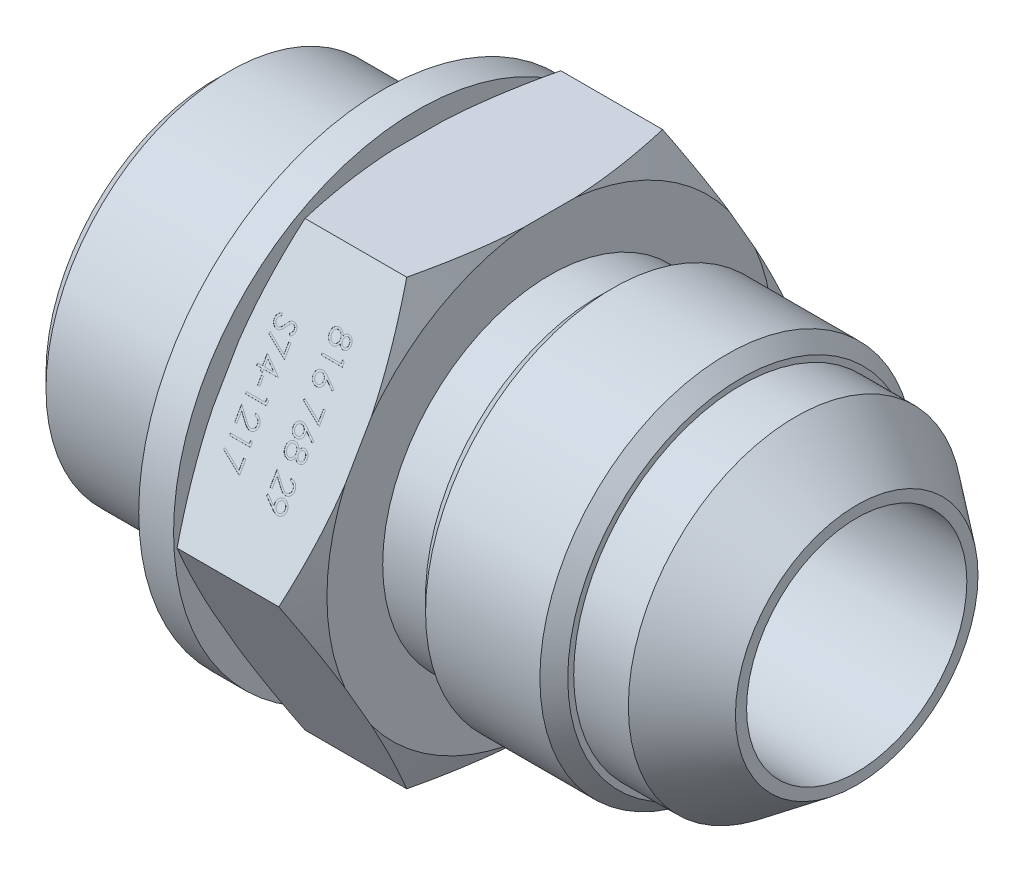
from build123d import *

# Parameters (mm, degrees)
SKETCH2_OUTSIDE_W  = 52.57
SKETCH2_OUTSIDE_H  = 52.57
EXTRUDE1_DEPTH     = 9.5
SKETCH3_R          = 17.5
SKETCH3_R_2        = 14.5
EXTRUDE2_DEPTH     = 2.5
CHAMFER1_SIZE      = 1
CHAMFER2_SIZE      = 1
SKETCH4_W          = 0.153846154
SKETCH4_H          = 0.576923077
CUT_EXTRUDE1_DEPTH = 0.01
SKETCH5_R          = 1.5


with BuildPart() as part:
    # Sketch1 → Revolve1 (revolve)
    with BuildSketch(Plane.XY, mode=Mode.PRIVATE) as revolve1_sk:
        Polygon((0, 10.5), (0, 13.15), (11.4, 13.15), (12.5, 12.05), (14.5, 12.05), (14.5, 16), (15.6, 18.35), (22.9, 18.35), (24, 16), (24, 12), (27.5, 12), (27.5, 13.425), (37.7, 13.425), (37.7, 12), (41.620752089, 12), (46, 8.7), (46, 7.9), (13, 7.9), (4.5033321, 7.9), align=None)
    revolve(revolve1_sk.sketch.rotate(Axis((0, 0, 0), (1, 0, 0)), 90), axis=Axis((0, 0, 0), (1, 0, 0)))

    # Sketch2 outside → Extrude1 (cut)
    with BuildSketch(Plane(origin=(24, 0, 0), x_dir=(0, 0, -1), z_dir=(1, 0, 0))):
        Rectangle(SKETCH2_OUTSIDE_W, SKETCH2_OUTSIDE_H)
        Polygon((9.175, 15.891566159), (-9.175, 15.891566159), (-18.35, 0), (-9.175, -15.891566159), (9.175, -15.891566159), (18.35, 0), align=None, mode=Mode.SUBTRACT)
    extrude(amount=-EXTRUDE1_DEPTH, mode=Mode.SUBTRACT)

    # Sketch3 → Extrude2 (add)
    with BuildSketch(Plane.ZY.offset(-14.5)):
        Circle(SKETCH3_R)
        Circle(SKETCH3_R_2, mode=Mode.SUBTRACT)
    extrude(amount=EXTRUDE2_DEPTH)

    # Chamfer1
    chamfer1_edges = [part.edges().sort_by_distance(p)[0] for p in [
        (0, 0, -13.15),
    ]]
    chamfer(chamfer1_edges, length=CHAMFER1_SIZE)

    # Chamfer2
    chamfer2_edges = [part.edges().sort_by_distance(p)[0] for p in [
        (27.5, 0, -13.425),
        (37.7, 0, -13.425),
    ]]
    chamfer(chamfer2_edges, length=CHAMFER2_SIZE)

    # Sketch4 → Cut-Extrude1 (cut)
    # profile 1 of 16: a face of its own
    with BuildSketch(Plane(origin=(0, 7.94578308, 13.7625), x_dir=(1, 0, 0), z_dir=(0, -0.49999999999999983, -0.8660254037844389))):
        with BuildLine():
            Line((19.631451776, 4.423076923), (19.706271487, 4.315504808))
            Line((19.706271487, 4.315504808), (20.315946968, 4.732572115))
            add(Edge.make_bspline(
                [(20.315946968, 4.732572115), (20.312692798, 4.7059618), (20.306285156, 4.653564606), (20.305108018, 4.600791562), (20.304528699, 4.574819712)],
                knots=[0, 0, 0, 0, 1.015715272, 2, 2, 2, 2], degree=3))
            add(Edge.make_bspline(
                [(20.304528699, 4.574819712), (20.304933213, 4.559073555), (20.30572724, 4.528165227), (20.31198529, 4.482716896), (20.321732934, 4.438981768), (20.335940793, 4.397126432), (20.354098808, 4.357188173), (20.376217641, 4.319027626), (20.402379622, 4.282695319), (20.432303537, 4.248618772), (20.465166767, 4.217628547), (20.499947443, 4.190018427), (20.537051512, 4.167072263), (20.575721584, 4.14801086), (20.616513597, 4.133554954), (20.658963339, 4.123028151), (20.703368329, 4.116547142), (20.733593385, 4.115776101), (20.748939756, 4.115384615)],
                knots=[0, 0, 0, 0, 1.060702494, 2.082066239, 3.085748733, 4.076089625, 5.054723785, 6.037561548, 7.043420247, 8.066922603, 9.088643095, 10.08373341, 11.053858765, 12.022809492, 12.983497605, 13.964038393, 14.966267459, 16, 16, 16, 16], degree=3))
            add(Edge.make_bspline(
                [(20.748939756, 4.115384615), (20.769926322, 4.116127945), (20.811118693, 4.117586949), (20.871304594, 4.129329171), (20.928213112, 4.148640745), (20.981694624, 4.175567192), (21.030979798, 4.209482072), (21.075383487, 4.250242897), (21.114274139, 4.297601739), (21.147704458, 4.350479747), (21.174590885, 4.407631041), (21.194407729, 4.467489038), (21.206064335, 4.529595089), (21.207601132, 4.571666948), (21.208374853, 4.592848558)],
                knots=[0, 0, 0, 0, 1.022988612, 2.007919123, 2.978103895, 3.94594894, 4.918897164, 5.887013414, 6.875921846, 7.89917871, 8.930658928, 9.948724884, 10.967259574, 12, 12, 12, 12], degree=3))
            add(Edge.make_bspline(
                [(21.208374853, 4.592848558), (21.207593316, 4.613630119), (21.206049072, 4.654692525), (21.194640177, 4.715155637), (21.175616596, 4.773117579), (21.149206428, 4.828122315), (21.115887338, 4.878787502), (21.076512293, 4.924522424), (21.030637625, 4.964101834), (20.979518143, 4.997457697), (20.924588323, 5.024229829), (20.867252649, 5.043546717), (20.807921692, 5.055437654), (20.76772407, 5.056936087), (20.747437353, 5.057692308)],
                knots=[0, 0, 0, 0, 1.026337322, 2.02794581, 3.027878252, 4.032696425, 5.033228651, 6.015458494, 7.004668777, 8.016190509, 9.023163053, 10.0152653, 10.998354841, 12, 12, 12, 12], degree=3))
            add(Edge.make_bspline(
                [(20.747437353, 5.057692308), (20.731688763, 5.057193513), (20.699746689, 5.056181834), (20.651262436, 5.048914006), (20.601724451, 5.037142911), (20.559740106, 5.023488944), (20.525416347, 5.009507243), (20.497870663, 4.997477825), (20.469124585, 4.983476503), (20.439389387, 4.966844984), (20.407882738, 4.949457333), (20.375292705, 4.929687253), (20.341437174, 4.908136418), (20.318617674, 4.892779597), (20.306932545, 4.884915865)],
                knots=[0, 0, 0, 0, 1.179688711, 2.392703466, 3.66501481, 4.991562144, 5.695278944, 6.441221078, 7.243328977, 8.089575748, 8.993388627, 9.939305498, 10.944784961, 12, 12, 12, 12], degree=3))
            Line((20.306932545, 4.884915865), (19.631451776, 4.423076923))
        make_face()
        with BuildLine():
            add(Edge.make_bspline(
                [(20.458374853, 4.599759615), (20.458700731, 4.611688479), (20.459335106, 4.63490992), (20.46319621, 4.668928762), (20.470042204, 4.701039135), (20.479864938, 4.731326813), (20.491717796, 4.760095486), (20.506808647, 4.786888198), (20.524815776, 4.811727373), (20.54504864, 4.834779342), (20.567527462, 4.855249627), (20.591054793, 4.873482355), (20.615733912, 4.888979741), (20.641873881, 4.901221145), (20.668838399, 4.911285963), (20.697061694, 4.91823654), (20.726396723, 4.922086968), (20.74632472, 4.922743358), (20.756451776, 4.923076923)],
                knots=[0, 0, 0, 0, 1.163407946, 2.26475976, 3.333800367, 4.359385343, 5.366239384, 6.363380779, 7.350133999, 8.353570782, 9.349036268, 10.310270964, 11.253520213, 12.184142, 13.120487599, 14.056272588, 15.012232024, 16, 16, 16, 16], degree=3))
            add(Edge.make_bspline(
                [(20.756451776, 4.923076923), (20.766583083, 4.922789948), (20.786548067, 4.922224429), (20.815926208, 4.91768664), (20.844081647, 4.909705795), (20.871161409, 4.898990381), (20.89696962, 4.88490128), (20.921674621, 4.867931751), (20.945581776, 4.848166493), (20.967459834, 4.824970618), (20.987887608, 4.800014066), (21.005596319, 4.773180214), (21.020712657, 4.745134674), (21.033079848, 4.715855099), (21.042749787, 4.685280542), (21.049698739, 4.65340935), (21.053544144, 4.620085854), (21.054196334, 4.597465268), (21.054528699, 4.5859375)],
                knots=[0, 0, 0, 0, 0.972051712, 1.915547132, 2.843788449, 3.775556853, 4.704594175, 5.659091977, 6.648619647, 7.675179132, 8.714041218, 9.74046568, 10.755438548, 11.767722258, 12.786148662, 13.828784001, 14.893517844, 16, 16, 16, 16], degree=3))
            add(Edge.make_bspline(
                [(21.054528699, 4.5859375), (21.054195857, 4.574509959), (21.053542825, 4.552089219), (21.049705367, 4.519062378), (21.042705528, 4.48740518), (21.033075178, 4.45692475), (21.020779926, 4.42770689), (21.005596434, 4.399884438), (20.987793018, 4.373330204), (20.967485846, 4.348380769), (20.945476743, 4.32523463), (20.921779081, 4.305121284), (20.896956541, 4.288191077), (20.871164885, 4.27408244), (20.844080719, 4.263372222), (20.81592646, 4.255389987), (20.786548001, 4.250852572), (20.766583061, 4.250287001), (20.756451776, 4.25)],
                knots=[0, 0, 0, 0, 1.099545523, 2.15729926, 3.193054709, 4.213957097, 5.228701859, 6.237665598, 7.258567987, 8.299955741, 9.329010984, 10.327149711, 11.283968076, 12.215264062, 13.149297769, 14.079795814, 15.025585048, 16, 16, 16, 16], degree=3))
            add(Edge.make_bspline(
                [(20.756451776, 4.25), (20.746316833, 4.250259683), (20.726328872, 4.250771824), (20.696960418, 4.255712306), (20.668808335, 4.263974426), (20.641598889, 4.275039879), (20.615596664, 4.289611989), (20.590924938, 4.307493638), (20.56730403, 4.328453158), (20.54510094, 4.352210367), (20.524721436, 4.378211007), (20.506922701, 4.405981041), (20.491891653, 4.4350424), (20.47983106, 4.465497384), (20.470140347, 4.497120299), (20.463208828, 4.530195355), (20.459372142, 4.564613171), (20.458710472, 4.587931735), (20.458374853, 4.599759615)],
                knots=[0, 0, 0, 0, 0.952633368, 1.87876736, 2.791047057, 3.707742249, 4.635551637, 5.587206343, 6.568248508, 7.601284464, 8.641511608, 9.671105535, 10.699146789, 11.713763218, 12.747829548, 13.806491675, 14.887386225, 16, 16, 16, 16], degree=3))
        make_face(mode=Mode.SUBTRACT)
    # profile 2 of 16: a face of its own
    with BuildSketch(Plane(origin=(0, 7.94578308, 13.7625), x_dir=(1, 0, 0), z_dir=(0, -0.49999999999999983, -0.8660254037844389))):
        with BuildLine():
            Line((20.708374853, 3.134615385), (20.708374853, 3))
            add(Edge.make_bspline(
                [(20.708374853, 3), (20.726233893, 3.000877202), (20.761308572, 3.002600003), (20.812446143, 3.010671383), (20.861331279, 3.022209826), (20.907544881, 3.03856249), (20.951639007, 3.058756602), (20.993028139, 3.083480039), (21.03212306, 3.112205738), (21.068183572, 3.144880999), (21.101147389, 3.180336669), (21.129914566, 3.218360313), (21.153941931, 3.258561121), (21.174137486, 3.300590406), (21.189278295, 3.344934251), (21.200517462, 3.391168778), (21.207278392, 3.439502962), (21.208005207, 3.472434362), (21.208374853, 3.489182692)],
                knots=[0, 0, 0, 0, 1.100776268, 2.161895295, 3.184016182, 4.190939212, 5.176500551, 6.166955529, 7.155448256, 8.160289653, 9.16017456, 10.133824356, 11.091467644, 12.04088621, 13.000931625, 13.972173743, 14.968683325, 16, 16, 16, 16], degree=3))
            add(Edge.make_bspline(
                [(21.208374853, 3.489182692), (21.2079898, 3.505630438), (21.207233185, 3.537949672), (21.200735601, 3.585119107), (21.190558919, 3.630023661), (21.176280883, 3.672575561), (21.157087557, 3.712435303), (21.134031469, 3.749902322), (21.107365827, 3.78542267), (21.075971336, 3.817397006), (21.042456028, 3.846757611), (21.006675498, 3.872087149), (20.96972009, 3.893778505), (20.931308003, 3.911858939), (20.891077563, 3.925168713), (20.849614476, 3.935273659), (20.806489557, 3.940985408), (20.777301033, 3.941862018), (20.762461391, 3.942307692)],
                knots=[0, 0, 0, 0, 1.111607364, 2.184268762, 3.212621178, 4.221274766, 5.211760367, 6.196651075, 7.1921475, 8.207485113, 9.220403448, 10.201281604, 11.166441695, 12.114753415, 13.065576456, 14.026450734, 14.996634279, 16, 16, 16, 16], degree=3))
            add(Edge.make_bspline(
                [(20.762461391, 3.942307692), (20.741569462, 3.941582008), (20.700152228, 3.940143375), (20.639288715, 3.927837213), (20.580320107, 3.90861728), (20.532861263, 3.885475556), (20.494618337, 3.862130223), (20.463131749, 3.841092719), (20.429229406, 3.816464943), (20.393024832, 3.787888444), (20.354234445, 3.755954356), (20.312881675, 3.720373429), (20.269393774, 3.680891937), (20.239691373, 3.65318115), (20.224300333, 3.638822115)],
                knots=[0, 0, 0, 0, 1.184426356, 2.348067706, 3.509069118, 4.696110526, 5.333549288, 6.050745305, 6.844228056, 7.710549037, 8.667450064, 9.695053472, 10.805634456, 12, 12, 12, 12], degree=3))
            Line((20.224300333, 3.638822115), (19.823759468, 3.263521635))
            Line((19.823759468, 3.263521635), (19.823759468, 3.961538462))
            Line((19.823759468, 3.961538462), (19.669913314, 3.961538462))
            Line((19.669913314, 3.961538462), (19.669913314, 2.942307692))
            Line((19.669913314, 2.942307692), (20.290706583, 3.524038462))
            add(Edge.make_bspline(
                [(20.290706583, 3.524038462), (20.305490765, 3.538202844), (20.333888154, 3.565409725), (20.375360032, 3.603874779), (20.41378889, 3.638478155), (20.449345016, 3.669242805), (20.481826839, 3.696194044), (20.511488913, 3.719245639), (20.538076685, 3.738499474), (20.569310888, 3.758904528), (20.607491258, 3.7783621), (20.65391497, 3.795463315), (20.701810224, 3.805816157), (20.734166617, 3.807064421), (20.75044216, 3.807692308)],
                knots=[0, 0, 0, 0, 1.329530082, 2.553755191, 3.672934919, 4.687409497, 5.60679272, 6.413407421, 7.126401618, 7.737995624, 8.834647426, 9.90044882, 10.943907757, 12, 12, 12, 12], degree=3))
            add(Edge.make_bspline(
                [(20.75044216, 3.807692308), (20.760678176, 3.807422645), (20.780851398, 3.806891193), (20.810409067, 3.802112023), (20.839031437, 3.795090474), (20.866364614, 3.784268099), (20.892946188, 3.771265412), (20.917967996, 3.754653522), (20.942282971, 3.735670494), (20.965057374, 3.713651112), (20.985922264, 3.689477922), (21.004403619, 3.6639367), (21.019849055, 3.636915443), (21.032510527, 3.608526762), (21.04244284, 3.578850148), (21.049325087, 3.54782811), (21.053646152, 3.51554639), (21.054230797, 3.493503463), (21.054528699, 3.482271635)],
                knots=[0, 0, 0, 0, 0.991504627, 1.954065223, 2.895985987, 3.842598665, 4.797835564, 5.759220273, 6.74786863, 7.784730864, 8.824135544, 9.839918996, 10.835834653, 11.835434876, 12.84861661, 13.863796685, 14.911511676, 16, 16, 16, 16], degree=3))
            add(Edge.make_bspline(
                [(21.054528699, 3.482271635), (21.054222349, 3.470541226), (21.053620729, 3.447504639), (21.049409701, 3.413682935), (21.042151984, 3.381414913), (21.032201807, 3.350635254), (21.019674457, 3.321314301), (21.003770042, 3.293717175), (20.985109529, 3.267591922), (20.963837564, 3.242986526), (20.94004235, 3.220378028), (20.91384345, 3.200096368), (20.885070443, 3.182798256), (20.854373225, 3.167464258), (20.820935595, 3.15573148), (20.785567825, 3.145702415), (20.747767421, 3.13841704), (20.721723799, 3.13590365), (20.708374853, 3.134615385)],
                knots=[0, 0, 0, 0, 1.031212865, 2.025131798, 2.990757446, 3.934781266, 4.865570067, 5.788494791, 6.729227313, 7.684356718, 8.643577152, 9.610526866, 10.590658432, 11.59095419, 12.621640561, 13.700587263, 14.82141059, 16, 16, 16, 16], degree=3))
        make_face()
    # profile 3 of 16: a face of its own
    with BuildSketch(Plane(origin=(0, 7.94578308, 13.7625), x_dir=(1, 0, 0), z_dir=(0, -0.49999999999999983, -0.8660254037844389))):
        with BuildLine():
            add(Edge.make_bspline(
                [(20.505550333, 1.940805288), (20.499140526, 1.952979437), (20.486600156, 1.976797364), (20.466472927, 2.010876299), (20.445447398, 2.042252205), (20.424183578, 2.07137223), (20.401840971, 2.097642424), (20.378674603, 2.121236616), (20.355305028, 2.142895019), (20.330817833, 2.161478971), (20.305718072, 2.177866595), (20.279789988, 2.192010047), (20.253115364, 2.204104356), (20.225396433, 2.213688148), (20.197042114, 2.22158329), (20.167685815, 2.227015668), (20.137521103, 2.229937211), (20.117134687, 2.230489558), (20.106812353, 2.230769231)],
                knots=[0, 0, 0, 0, 1.264385854, 2.473688339, 3.635349404, 4.734491366, 5.785876313, 6.801388178, 7.772322209, 8.711311751, 9.622826105, 10.524996139, 11.423212571, 12.31118177, 13.217849097, 14.126010572, 15.051135535, 16, 16, 16, 16], degree=3))
            add(Edge.make_bspline(
                [(20.106812353, 2.230769231), (20.092369475, 2.230441563), (20.063781603, 2.229792985), (20.02160483, 2.224050235), (19.980545133, 2.215668812), (19.940999468, 2.202617123), (19.90247228, 2.187027694), (19.865668008, 2.166972806), (19.829557512, 2.144466852), (19.807351454, 2.126353046), (19.796115237, 2.1171875)],
                knots=[0, 0, 0, 0, 1.02534174, 2.029536028, 3.018826961, 3.997522084, 4.983122576, 5.966563916, 6.971085759, 8, 8, 8, 8], degree=3))
            add(Edge.make_bspline(
                [(19.796115237, 2.1171875), (19.78300362, 2.105257582), (19.756942409, 2.081545169), (19.723106347, 2.040923914), (19.694670893, 1.996343107), (19.671497223, 1.94797525), (19.653460427, 1.895949635), (19.640499348, 1.840277347), (19.633075449, 1.780849853), (19.632002311, 1.740004651), (19.631451776, 1.719050481)],
                knots=[0, 0, 0, 0, 0.954267603, 1.896743057, 2.838368354, 3.796610408, 4.779680527, 5.799409237, 6.871065594, 8, 8, 8, 8], degree=3))
            add(Edge.make_bspline(
                [(19.631451776, 1.719050481), (19.63194702, 1.69890235), (19.632910716, 1.659696133), (19.639404367, 1.602622083), (19.65090061, 1.549355512), (19.666310204, 1.499643883), (19.686859247, 1.453967846), (19.712046435, 1.412244519), (19.741302857, 1.373861767), (19.775333601, 1.340025927), (19.811787991, 1.309988454), (19.849395565, 1.283602035), (19.888161355, 1.261670316), (19.927506924, 1.243101553), (19.967983852, 1.228886688), (20.009383856, 1.219041455), (20.051634632, 1.212788892), (20.080148198, 1.211956977), (20.094492641, 1.211538462)],
                knots=[0, 0, 0, 0, 1.256882982, 2.445766618, 3.576898315, 4.651879663, 5.686612882, 6.692806257, 7.686348993, 8.689277895, 9.678883454, 10.630458183, 11.551151498, 12.454054546, 13.341321255, 14.221808008, 15.105437234, 16, 16, 16, 16], degree=3))
            add(Edge.make_bspline(
                [(20.094492641, 1.211538462), (20.105018017, 1.211786113), (20.125819875, 1.212275559), (20.156552329, 1.215663524), (20.186465385, 1.221109368), (20.215666982, 1.228508645), (20.243953954, 1.238524595), (20.271425142, 1.250661149), (20.298291614, 1.26467552), (20.324091506, 1.281473278), (20.349684642, 1.299966792), (20.373820948, 1.321904303), (20.397845011, 1.34596461), (20.420717311, 1.373130066), (20.443537181, 1.402569204), (20.464852401, 1.435174301), (20.486222542, 1.470029304), (20.498997195, 1.494803407), (20.505550333, 1.507512019)],
                knots=[0, 0, 0, 0, 0.941717298, 1.86116577, 2.762973304, 3.660719123, 4.553575492, 5.444450535, 6.34648071, 7.261375261, 8.197060099, 9.168336537, 10.175980388, 11.237504102, 12.343496232, 13.506792996, 14.721035322, 16, 16, 16, 16], degree=3))
            add(Edge.make_bspline(
                [(20.505550333, 1.507512019), (20.515035185, 1.490113914), (20.533400512, 1.456426312), (20.567169162, 1.411849532), (20.603608913, 1.373498458), (20.643924111, 1.342859358), (20.686339125, 1.31854698), (20.730718033, 1.301378419), (20.776529442, 1.290167136), (20.807769519, 1.289031753), (20.823458987, 1.288461538)],
                knots=[0, 0, 0, 0, 1.16709546, 2.25982348, 3.287408737, 4.277418348, 5.234967981, 6.16072867, 7.076276605, 8, 8, 8, 8], degree=3))
            add(Edge.make_bspline(
                [(20.823458987, 1.288461538), (20.839443638, 1.289162448), (20.871575574, 1.290571399), (20.919407031, 1.301964041), (20.966384512, 1.320530623), (21.012286819, 1.34577916), (21.055535207, 1.377243628), (21.094455036, 1.414984942), (21.128252942, 1.458357326), (21.156806521, 1.5065907), (21.180161584, 1.558395752), (21.196104656, 1.613149053), (21.206590709, 1.669872144), (21.207774585, 1.70848619), (21.208374853, 1.728064904)],
                knots=[0, 0, 0, 0, 0.888753872, 1.786550278, 2.720173491, 3.693036334, 4.694165094, 5.687489879, 6.699912706, 7.744713188, 8.800178723, 9.852977058, 10.911381959, 12, 12, 12, 12], degree=3))
            add(Edge.make_bspline(
                [(21.208374853, 1.728064904), (21.207757646, 1.747138655), (21.206540586, 1.78474992), (21.196290435, 1.840117596), (21.179361122, 1.893137777), (21.156309762, 1.943521145), (21.127564023, 1.99016684), (21.093425156, 2.031814225), (21.054642081, 2.068346746), (21.011510821, 2.098699756), (20.965609627, 2.123194901), (20.917871543, 2.140639186), (20.868936271, 2.151735174), (20.835836161, 2.153141535), (20.819252256, 2.153846154)],
                knots=[0, 0, 0, 0, 1.072712831, 2.115267497, 3.156282165, 4.197922255, 5.225560591, 6.230883479, 7.219814004, 8.214446311, 9.19021444, 10.138875805, 11.067534608, 12, 12, 12, 12], degree=3))
            add(Edge.make_bspline(
                [(20.819252256, 2.153846154), (20.802976447, 2.153231431), (20.771011682, 2.152024149), (20.724415978, 2.141865772), (20.680772825, 2.124764768), (20.639618187, 2.101392292), (20.601521463, 2.070977302), (20.566609315, 2.033571901), (20.533493901, 1.990336935), (20.515073065, 1.9576849), (20.505550333, 1.940805288)],
                knots=[0, 0, 0, 0, 0.975287281, 1.915408787, 2.843441052, 3.776938647, 4.743139116, 5.754296123, 6.83907365, 8, 8, 8, 8], degree=3))
        make_face()
        with BuildLine():
            add(Edge.make_bspline(
                [(21.054528699, 1.720552885), (21.05424951, 1.710031111), (21.053703295, 1.68944592), (21.050849593, 1.659262204), (21.045298214, 1.630559761), (21.037910195, 1.603038703), (21.027929629, 1.577076355), (21.016188911, 1.552320118), (21.001914882, 1.529191322), (20.98590294, 1.507410764), (20.968291695, 1.487803289), (20.949942958, 1.470401338), (20.930496362, 1.455946432), (20.910435636, 1.443671671), (20.889165389, 1.434765306), (20.867337742, 1.42809489), (20.844676863, 1.423585722), (20.829189787, 1.423247841), (20.821355622, 1.423076923)],
                knots=[0, 0, 0, 0, 1.203892937, 2.355340988, 3.463153438, 4.544400666, 5.610487187, 6.640501085, 7.674077295, 8.714426146, 9.728707835, 10.68524104, 11.601827946, 12.495867327, 13.368432065, 14.231010473, 15.105153427, 16, 16, 16, 16], degree=3))
            add(Edge.make_bspline(
                [(20.821355622, 1.423076923), (20.813524648, 1.423381682), (20.798049517, 1.42398393), (20.775105477, 1.428343019), (20.752851969, 1.435631452), (20.73108125, 1.445625461), (20.709849201, 1.458450901), (20.689074464, 1.474017155), (20.669306408, 1.492999639), (20.649984177, 1.51396203), (20.63218232, 1.536859732), (20.616280726, 1.560921052), (20.603604116, 1.58632159), (20.592489319, 1.61230066), (20.584151933, 1.639407658), (20.578145337, 1.667455678), (20.574429883, 1.696414759), (20.573984708, 1.716034675), (20.573759468, 1.725961538)],
                knots=[0, 0, 0, 0, 0.873213166, 1.72559466, 2.594724523, 3.479581045, 4.391597569, 5.35687048, 6.368548091, 7.443976143, 8.534559525, 9.600545123, 10.654815915, 11.696401765, 12.749428718, 13.812189468, 14.893058657, 16, 16, 16, 16], degree=3))
            add(Edge.make_bspline(
                [(20.573759468, 1.725961538), (20.574133554, 1.738711583), (20.574878031, 1.764085741), (20.581799963, 1.801491168), (20.592688213, 1.837860873), (20.607585341, 1.872806118), (20.626282996, 1.905422369), (20.648668575, 1.934496684), (20.674225188, 1.959781066), (20.702554975, 1.981012756), (20.732705655, 1.997474119), (20.762962924, 2.01028918), (20.793649594, 2.017772558), (20.814206864, 2.018748658), (20.82436043, 2.019230769)],
                knots=[0, 0, 0, 0, 1.076279235, 2.141928126, 3.20205304, 4.278698113, 5.344010996, 6.36967002, 7.368914609, 8.37248503, 9.349703398, 10.264243087, 11.142681841, 12, 12, 12, 12], degree=3))
            add(Edge.make_bspline(
                [(20.82436043, 2.019230769), (20.831487074, 2.019003402), (20.845632443, 2.018552112), (20.866515259, 2.01481485), (20.886947298, 2.008686977), (20.906933511, 2.0002347), (20.926754942, 1.989763831), (20.945574798, 1.976237396), (20.96444045, 1.960882608), (20.982515833, 1.943045409), (20.999536006, 1.922936909), (21.014177731, 1.900239652), (21.026893832, 1.875530987), (21.037111395, 1.848609332), (21.044806816, 1.819579736), (21.050563566, 1.788553081), (21.053809667, 1.755277215), (21.054283823, 1.732378704), (21.054528699, 1.720552885)],
                knots=[0, 0, 0, 0, 0.814272661, 1.61621452, 2.416847352, 3.248328223, 4.093649164, 4.973549185, 5.892801723, 6.872536627, 7.872406081, 8.898230315, 9.953166191, 11.044090313, 12.18293744, 13.382234284, 14.648068262, 16, 16, 16, 16], degree=3))
        make_face(mode=Mode.SUBTRACT)
        with BuildLine():
            add(Edge.make_bspline(
                [(20.419913314, 1.729266827), (20.419676129, 1.715927157), (20.419210828, 1.689757979), (20.414028349, 1.651419971), (20.406820356, 1.614623298), (20.395861909, 1.579506512), (20.381730618, 1.546112665), (20.364441346, 1.514366534), (20.344309674, 1.484223197), (20.321225613, 1.456176554), (20.29622499, 1.43062314), (20.270096629, 1.407810358), (20.242652861, 1.388821282), (20.214138492, 1.373304736), (20.184589044, 1.361285138), (20.154010452, 1.352410001), (20.12231132, 1.347258114), (20.100820805, 1.346523988), (20.08998543, 1.346153846)],
                knots=[0, 0, 0, 0, 1.140506561, 2.237395584, 3.304560074, 4.345354409, 5.3782877, 6.402081073, 7.433555996, 8.474808822, 9.504965884, 10.489266388, 11.437701257, 12.354123303, 13.261162422, 14.161620169, 15.073101032, 16, 16, 16, 16], degree=3))
            add(Edge.make_bspline(
                [(20.08998543, 1.346153846), (20.076514179, 1.346736488), (20.049787533, 1.347892436), (20.01030187, 1.35711206), (19.971968047, 1.371793734), (19.935460556, 1.39277605), (19.901234177, 1.418213911), (19.871057645, 1.44928958), (19.8448234, 1.484788356), (19.823312685, 1.525064348), (19.806057758, 1.56899861), (19.794317155, 1.61670501), (19.786486197, 1.667510016), (19.785700261, 1.702593295), (19.78529793, 1.720552885)],
                knots=[0, 0, 0, 0, 0.898956152, 1.783507998, 2.694187257, 3.631865312, 4.587204618, 5.533364321, 6.51415483, 7.525942309, 8.574485006, 9.65837228, 10.801290154, 12, 12, 12, 12], degree=3))
            add(Edge.make_bspline(
                [(19.78529793, 1.720552885), (19.785567114, 1.734588877), (19.78609157, 1.761935493), (19.790730495, 1.801827796), (19.798065282, 1.839481422), (19.808835481, 1.874877894), (19.821738831, 1.908441391), (19.838613682, 1.939421371), (19.857697743, 1.96864299), (19.88034887, 1.994734493), (19.904572984, 2.01846274), (19.930085367, 2.039245639), (19.956626194, 2.056834656), (19.984181031, 2.071013021), (20.012648335, 2.082272015), (20.042145038, 2.090388464), (20.072786981, 2.095390861), (20.093572143, 2.095897191), (20.104108026, 2.096153846)],
                knots=[0, 0, 0, 0, 1.22469164, 2.386092043, 3.500511288, 4.568136916, 5.611981868, 6.63276519, 7.641422348, 8.65223666, 9.641383647, 10.598487484, 11.519869765, 12.415254456, 13.298392158, 14.187051141, 15.081026348, 16, 16, 16, 16], degree=3))
            add(Edge.make_bspline(
                [(20.104108026, 2.096153846), (20.114342319, 2.095768169), (20.134522558, 2.095007682), (20.164405857, 2.090112203), (20.193393949, 2.081706614), (20.221362092, 2.06945592), (20.248612566, 2.054389171), (20.27494403, 2.035907792), (20.300147667, 2.013795284), (20.324249763, 1.988749278), (20.346543976, 1.96147018), (20.366263988, 1.932469104), (20.38287216, 1.901974564), (20.396379197, 1.870049698), (20.407002407, 1.836765762), (20.414423545, 1.802147138), (20.419094804, 1.766153322), (20.419637395, 1.741701234), (20.419913314, 1.729266827)],
                knots=[0, 0, 0, 0, 0.917481483, 1.809113215, 2.707052678, 3.61610275, 4.54058801, 5.494688304, 6.493986409, 7.541809048, 8.607637092, 9.648666143, 10.681335566, 11.715370464, 12.751897579, 13.808646822, 14.885650252, 16, 16, 16, 16], degree=3))
        make_face(mode=Mode.SUBTRACT)
    # profile 4 of 16: a face of its own
    with BuildSketch(Plane(origin=(0, 7.94578308, 13.7625), x_dir=(1, 0, 0), z_dir=(0, -0.49999999999999983, -0.8660254037844389))):
        with BuildLine():
            Line((21.208374853, 0.75), (21.126944564, 0.853665865))
            Line((21.126944564, 0.853665865), (20.520874853, 0.457331731))
            add(Edge.make_bspline(
                [(20.520874853, 0.457331731), (20.525080793, 0.483718992), (20.533284955, 0.53519033), (20.53463836, 0.58729), (20.53529793, 0.612680288)],
                knots=[0, 0, 0, 0, 1.025318673, 2, 2, 2, 2], degree=3))
            add(Edge.make_bspline(
                [(20.53529793, 0.612680288), (20.534888167, 0.627925644), (20.534081563, 0.657935673), (20.527874198, 0.701995731), (20.518092007, 0.744333846), (20.503832469, 0.784774537), (20.485617174, 0.823462958), (20.46378623, 0.860621128), (20.437212367, 0.895550561), (20.407527386, 0.928701066), (20.374648678, 0.958798394), (20.339762391, 0.985445275), (20.302904871, 1.007828185), (20.264094785, 1.025988437), (20.22339196, 1.040090528), (20.180848471, 1.050370947), (20.136434984, 1.056447916), (20.106230051, 1.057273126), (20.090886872, 1.057692308)],
                knots=[0, 0, 0, 0, 1.04369286, 2.054478336, 3.041073146, 4.015093852, 4.984733326, 5.965804835, 6.960378782, 7.985147595, 9.009457201, 10.008161701, 10.986880575, 11.956520048, 12.937015923, 13.931873656, 14.949455224, 16, 16, 16, 16], degree=3))
            add(Edge.make_bspline(
                [(20.090886872, 1.057692308), (20.069908049, 1.05690951), (20.02865103, 1.055370057), (19.96830928, 1.044163493), (19.911284385, 1.024823468), (19.857352246, 0.998948833), (19.80808202, 0.965378529), (19.763554948, 0.925595873), (19.724743064, 0.879224808), (19.691447965, 0.827363411), (19.664995051, 0.771233273), (19.645437871, 0.712378987), (19.63375196, 0.651303609), (19.63222203, 0.609825023), (19.631451776, 0.588942308)],
                knots=[0, 0, 0, 0, 1.031881447, 2.029301251, 3.006342947, 3.987068354, 4.962916383, 5.929513747, 6.915671209, 7.928552063, 8.953527267, 9.960179832, 10.973036711, 12, 12, 12, 12], degree=3))
            add(Edge.make_bspline(
                [(19.631451776, 0.588942308), (19.632106719, 0.568758004), (19.633404048, 0.528776431), (19.644960903, 0.469962433), (19.663692427, 0.413449496), (19.689498891, 0.359634858), (19.722093844, 0.309780149), (19.761339548, 0.265191716), (19.806368626, 0.226024691), (19.857319212, 0.193601323), (19.911716353, 0.167176191), (19.968953962, 0.148538163), (20.027880108, 0.136484901), (20.067991827, 0.135241344), (20.088182545, 0.134615385)],
                knots=[0, 0, 0, 0, 1.011913813, 2.004424092, 2.994488568, 3.992479987, 4.990471406, 5.973328987, 6.963763268, 7.974390938, 8.994854117, 9.989689954, 10.988086187, 12, 12, 12, 12], degree=3))
            add(Edge.make_bspline(
                [(20.088182545, 0.134615385), (20.103624599, 0.135159005), (20.135140292, 0.136268481), (20.183009766, 0.142889704), (20.231798579, 0.155033836), (20.273158145, 0.168176441), (20.307411359, 0.181217872), (20.334460217, 0.193310188), (20.363024679, 0.20683087), (20.392564279, 0.222678992), (20.423923026, 0.23947928), (20.455939609, 0.259103923), (20.489783375, 0.27958254), (20.512316028, 0.294584653), (20.52387966, 0.302283654)],
                knots=[0, 0, 0, 0, 1.17367173, 2.395347028, 3.66355231, 4.98980831, 5.690886799, 6.447442954, 7.240630024, 8.091733897, 8.994365608, 9.943299771, 10.944512865, 12, 12, 12, 12], degree=3))
            Line((20.52387966, 0.302283654), (21.208374853, 0.75))
        make_face()
        with BuildLine():
            add(Edge.make_bspline(
                [(20.381451776, 0.584435096), (20.381113911, 0.573008778), (20.380451024, 0.550590437), (20.376707032, 0.517740981), (20.369613193, 0.486735047), (20.36043715, 0.457218497), (20.347943324, 0.429498972), (20.332947192, 0.403260273), (20.31511777, 0.378762766), (20.294653854, 0.356436667), (20.2725761, 0.335935795), (20.248787176, 0.318301696), (20.224013876, 0.303073935), (20.198023361, 0.290697035), (20.170832302, 0.281058156), (20.142563972, 0.274086123), (20.113029291, 0.270205924), (20.093001072, 0.269560399), (20.082773891, 0.269230769)],
                knots=[0, 0, 0, 0, 1.129474985, 2.216020618, 3.260639938, 4.268601163, 5.26556745, 6.258792394, 7.250684778, 8.252748164, 9.247500881, 10.223461414, 11.174097059, 12.117127289, 13.062595836, 14.020469732, 14.98917545, 16, 16, 16, 16], degree=3))
            add(Edge.make_bspline(
                [(20.082773891, 0.269230769), (20.072638571, 0.269499902), (20.052764718, 0.27002763), (20.023470992, 0.274797325), (19.995306682, 0.282135097), (19.968251187, 0.29287565), (19.942452092, 0.306347445), (19.917726137, 0.322925973), (19.894056256, 0.342330521), (19.872039319, 0.364887923), (19.85184485, 0.389213895), (19.833863656, 0.414940221), (19.818764262, 0.441985101), (19.806827001, 0.470502857), (19.7970501, 0.500094218), (19.79016525, 0.530984926), (19.786273964, 0.563202123), (19.785627544, 0.585025775), (19.78529793, 0.596153846)],
                knots=[0, 0, 0, 0, 0.989642335, 1.94054129, 2.892446913, 3.828371744, 4.778262963, 5.730973156, 6.732161388, 7.763274768, 8.805796303, 9.818398792, 10.825975928, 11.825728216, 12.834635236, 13.867465554, 14.912602056, 16, 16, 16, 16], degree=3))
            add(Edge.make_bspline(
                [(19.78529793, 0.596153846), (19.785627519, 0.607281935), (19.786273887, 0.629105623), (19.790165541, 0.661322561), (19.797049032, 0.692214227), (19.80683087, 0.721802106), (19.818749911, 0.750332715), (19.833958271, 0.77740127), (19.851735523, 0.803373213), (19.872074076, 0.827683226), (19.89393185, 0.850334912), (19.917940451, 0.869284963), (19.942255573, 0.886387245), (19.968353995, 0.899341625), (19.995290395, 0.910201795), (20.023475356, 0.917502545), (20.052763575, 0.92228211), (20.072638185, 0.922808482), (20.082773891, 0.923076923)],
                knots=[0, 0, 0, 0, 1.087205562, 2.132157158, 3.164804748, 4.173533273, 5.173108684, 6.180507559, 7.20098426, 8.243321352, 9.274252308, 10.269075238, 11.227079059, 12.172305571, 13.108064818, 14.05980203, 15.010532752, 16, 16, 16, 16], degree=3))
            add(Edge.make_bspline(
                [(20.082773891, 0.923076923), (20.093015601, 0.922843832), (20.113116748, 0.92238635), (20.142537362, 0.917111775), (20.171062171, 0.909987584), (20.198048607, 0.898474237), (20.224242955, 0.884760902), (20.24889656, 0.867291014), (20.272707864, 0.847261359), (20.294800277, 0.824065076), (20.315007797, 0.798829596), (20.332844319, 0.771993502), (20.347897994, 0.743918878), (20.360458151, 0.714632844), (20.369522219, 0.683800196), (20.376659321, 0.651918617), (20.380457329, 0.618580372), (20.381116071, 0.595961825), (20.381451776, 0.584435096)],
                knots=[0, 0, 0, 0, 0.978265087, 1.920016216, 2.851775529, 3.783928695, 4.718195979, 5.674835085, 6.667117013, 7.690134047, 8.732874136, 9.755756613, 10.767227014, 11.776017537, 12.797239016, 13.836276431, 14.897336092, 16, 16, 16, 16], degree=3))
        make_face(mode=Mode.SUBTRACT)
    # profile 5 of 16: a face of its own
    with BuildSketch(Plane(origin=(0, 7.94578308, 13.7625), x_dir=(1, 0, 0), z_dir=(0, -0.49999999999999983, -0.8660254037844389))):
        Polygon((21.169913314, -1), (21.169913314, -0.076923077), (19.631451776, -0.865384615), (19.69545418, -0.981670673), (21.01606716, -0.3046875), (21.01606716, -1), align=None)
    # profile 6 of 16: a face of its own
    with BuildSketch(Plane(origin=(0, 7.94578308, 13.7625), x_dir=(1, 0, 0), z_dir=(0, -0.49999999999999983, -0.8660254037844389))):
        with BuildLine():
            Line((21.208374853, -2.134615385), (21.126944564, -2.030949519))
            Line((21.126944564, -2.030949519), (20.520874853, -2.427283654))
            add(Edge.make_bspline(
                [(20.520874853, -2.427283654), (20.525080793, -2.400896392), (20.533284955, -2.349425055), (20.53463836, -2.297325384), (20.53529793, -2.271935096)],
                knots=[0, 0, 0, 0, 1.025318673, 2, 2, 2, 2], degree=3))
            add(Edge.make_bspline(
                [(20.53529793, -2.271935096), (20.534888167, -2.256689741), (20.534081563, -2.226679712), (20.527874198, -2.182619654), (20.518092007, -2.140281538), (20.503832469, -2.099840847), (20.485617174, -2.061152427), (20.46378623, -2.023994257), (20.437212367, -1.989064824), (20.407527386, -1.955914319), (20.374648678, -1.925816991), (20.339762391, -1.89917011), (20.302904871, -1.876787199), (20.264094785, -1.858626947), (20.22339196, -1.844524856), (20.180848471, -1.834244437), (20.136434984, -1.828167469), (20.106230051, -1.827342258), (20.090886872, -1.826923077)],
                knots=[0, 0, 0, 0, 1.04369286, 2.054478336, 3.041073146, 4.015093852, 4.984733326, 5.965804835, 6.960378782, 7.985147595, 9.009457201, 10.008161701, 10.986880575, 11.956520048, 12.937015923, 13.931873656, 14.949455224, 16, 16, 16, 16], degree=3))
            add(Edge.make_bspline(
                [(20.090886872, -1.826923077), (20.069908049, -1.827705875), (20.02865103, -1.829245328), (19.96830928, -1.840451892), (19.911284385, -1.859791917), (19.857352246, -1.885666552), (19.80808202, -1.919236856), (19.763554948, -1.959019512), (19.724743064, -2.005390577), (19.691447965, -2.057251974), (19.664995051, -2.113382112), (19.645437871, -2.172236397), (19.63375196, -2.233311776), (19.63222203, -2.274790361), (19.631451776, -2.295673077)],
                knots=[0, 0, 0, 0, 1.031881447, 2.029301251, 3.006342947, 3.987068354, 4.962916383, 5.929513747, 6.915671209, 7.928552063, 8.953527267, 9.960179832, 10.973036711, 12, 12, 12, 12], degree=3))
            add(Edge.make_bspline(
                [(19.631451776, -2.295673077), (19.632106719, -2.315857381), (19.633404048, -2.355838954), (19.644960903, -2.414652951), (19.663692427, -2.471165889), (19.689498891, -2.524980526), (19.722093844, -2.574835235), (19.761339548, -2.619423669), (19.806368626, -2.658590694), (19.857319212, -2.691014061), (19.911716353, -2.717439194), (19.968953962, -2.736077222), (20.027880108, -2.748130483), (20.067991827, -2.74937404), (20.088182545, -2.75)],
                knots=[0, 0, 0, 0, 1.011913813, 2.004424092, 2.994488568, 3.992479987, 4.990471406, 5.973328987, 6.963763268, 7.974390938, 8.994854117, 9.989689954, 10.988086187, 12, 12, 12, 12], degree=3))
            add(Edge.make_bspline(
                [(20.088182545, -2.75), (20.103624599, -2.749456379), (20.135140292, -2.748346904), (20.183009766, -2.741725681), (20.231798579, -2.729581549), (20.273158145, -2.716438944), (20.307411359, -2.703397512), (20.334460217, -2.691305197), (20.363024679, -2.677784515), (20.392564279, -2.661936393), (20.423923026, -2.645136105), (20.455939609, -2.625511461), (20.489783375, -2.605032844), (20.512316028, -2.590030732), (20.52387966, -2.582331731)],
                knots=[0, 0, 0, 0, 1.17367173, 2.395347028, 3.66355231, 4.98980831, 5.690886799, 6.447442954, 7.240630024, 8.091733897, 8.994365608, 9.943299771, 10.944512865, 12, 12, 12, 12], degree=3))
            Line((20.52387966, -2.582331731), (21.208374853, -2.134615385))
        make_face()
        with BuildLine():
            add(Edge.make_bspline(
                [(20.381451776, -2.300180288), (20.381113911, -2.311606606), (20.380451024, -2.334024948), (20.376707032, -2.366874404), (20.369613193, -2.397880338), (20.36043715, -2.427396887), (20.347943324, -2.455116413), (20.332947192, -2.481355111), (20.31511777, -2.505852619), (20.294653854, -2.528178718), (20.2725761, -2.54867959), (20.248787176, -2.566313688), (20.224013876, -2.581541449), (20.198023361, -2.59391835), (20.170832302, -2.603557228), (20.142563972, -2.610529261), (20.113029291, -2.61440946), (20.093001072, -2.615054985), (20.082773891, -2.615384615)],
                knots=[0, 0, 0, 0, 1.129474985, 2.216020618, 3.260639938, 4.268601163, 5.26556745, 6.258792394, 7.250684778, 8.252748164, 9.247500881, 10.223461414, 11.174097059, 12.117127289, 13.062595836, 14.020469732, 14.98917545, 16, 16, 16, 16], degree=3))
            add(Edge.make_bspline(
                [(20.082773891, -2.615384615), (20.072638571, -2.615115483), (20.052764718, -2.614587755), (20.023470992, -2.609818059), (19.995306682, -2.602480288), (19.968251187, -2.591739734), (19.942452092, -2.57826794), (19.917726137, -2.561689411), (19.894056256, -2.542284863), (19.872039319, -2.519727461), (19.85184485, -2.49540149), (19.833863656, -2.469675164), (19.818764262, -2.442630283), (19.806827001, -2.414112527), (19.7970501, -2.384521166), (19.79016525, -2.353630458), (19.786273964, -2.321413261), (19.785627544, -2.299589609), (19.78529793, -2.288461538)],
                knots=[0, 0, 0, 0, 0.989642335, 1.94054129, 2.892446913, 3.828371744, 4.778262963, 5.730973156, 6.732161388, 7.763274768, 8.805796303, 9.818398792, 10.825975928, 11.825728216, 12.834635236, 13.867465554, 14.912602056, 16, 16, 16, 16], degree=3))
            add(Edge.make_bspline(
                [(19.78529793, -2.288461538), (19.785627519, -2.277333449), (19.786273887, -2.255509762), (19.790165541, -2.223292824), (19.797049032, -2.192401158), (19.80683087, -2.162813279), (19.818749911, -2.134282669), (19.833958271, -2.107214115), (19.851735523, -2.081242171), (19.872074076, -2.056932158), (19.89393185, -2.034280473), (19.917940451, -2.015330422), (19.942255573, -1.99822814), (19.968353995, -1.985273759), (19.995290395, -1.97441359), (20.023475356, -1.96711284), (20.052763575, -1.962333274), (20.072638185, -1.961806902), (20.082773891, -1.961538462)],
                knots=[0, 0, 0, 0, 1.087205562, 2.132157158, 3.164804748, 4.173533273, 5.173108684, 6.180507559, 7.20098426, 8.243321352, 9.274252308, 10.269075238, 11.227079059, 12.172305571, 13.108064818, 14.05980203, 15.010532752, 16, 16, 16, 16], degree=3))
            add(Edge.make_bspline(
                [(20.082773891, -1.961538462), (20.093015601, -1.961771553), (20.113116748, -1.962229034), (20.142537362, -1.96750361), (20.171062171, -1.974627801), (20.198048607, -1.986141147), (20.224242955, -1.999854483), (20.24889656, -2.017324371), (20.272707864, -2.037354025), (20.294800277, -2.060550309), (20.315007797, -2.085785789), (20.332844319, -2.112621882), (20.347897994, -2.140696507), (20.360458151, -2.169982541), (20.369522219, -2.200815189), (20.376659321, -2.232696767), (20.380457329, -2.266035013), (20.381116071, -2.28865356), (20.381451776, -2.300180288)],
                knots=[0, 0, 0, 0, 0.978265087, 1.920016216, 2.851775529, 3.783928695, 4.718195979, 5.674835085, 6.667117013, 7.690134047, 8.732874136, 9.755756613, 10.767227014, 11.776017537, 12.797239016, 13.836276431, 14.897336092, 16, 16, 16, 16], degree=3))
        make_face(mode=Mode.SUBTRACT)
    # profile 7 of 16: a face of its own
    with BuildSketch(Plane(origin=(0, 7.94578308, 13.7625), x_dir=(1, 0, 0), z_dir=(0, -0.49999999999999983, -0.8660254037844389))):
        Polygon((21.169913314, -3.661959135), (21.169913314, -3.384615385), (19.669913314, -3.384615385), (19.669913314, -3.519230769), (21.01606716, -3.519230769), (21.01606716, -3.75), align=None)
    # profile 8 of 16: a face of its own
    with BuildSketch(Plane(origin=(0, 7.94578308, 13.7625), x_dir=(1, 0, 0), z_dir=(0, -0.49999999999999983, -0.8660254037844389))):
        with BuildLine():
            add(Edge.make_bspline(
                [(20.505550333, -4.405348558), (20.499140526, -4.393174409), (20.486600156, -4.369356483), (20.466472927, -4.335277547), (20.445447398, -4.303901641), (20.424183578, -4.274781616), (20.401840971, -4.248511422), (20.378674603, -4.22491723), (20.355305028, -4.203258827), (20.330817833, -4.184674875), (20.305718072, -4.168287251), (20.279789988, -4.154143799), (20.253115364, -4.14204949), (20.225396433, -4.132465698), (20.197042114, -4.124570556), (20.167685815, -4.119138178), (20.137521103, -4.116216636), (20.117134687, -4.115664288), (20.106812353, -4.115384615)],
                knots=[0, 0, 0, 0, 1.264385854, 2.473688339, 3.635349404, 4.734491366, 5.785876313, 6.801388178, 7.772322209, 8.711311751, 9.622826105, 10.524996139, 11.423212571, 12.31118177, 13.217849097, 14.126010572, 15.051135535, 16, 16, 16, 16], degree=3))
            add(Edge.make_bspline(
                [(20.106812353, -4.115384615), (20.092369475, -4.115712283), (20.063781603, -4.116360861), (20.02160483, -4.122103611), (19.980545133, -4.130485034), (19.940999468, -4.143536723), (19.90247228, -4.159126152), (19.865668008, -4.17918104), (19.829557512, -4.201686994), (19.807351454, -4.2198008), (19.796115237, -4.228966346)],
                knots=[0, 0, 0, 0, 1.02534174, 2.029536028, 3.018826961, 3.997522084, 4.983122576, 5.966563916, 6.971085759, 8, 8, 8, 8], degree=3))
            add(Edge.make_bspline(
                [(19.796115237, -4.228966346), (19.78300362, -4.240896264), (19.756942409, -4.264608678), (19.723106347, -4.305229932), (19.694670893, -4.34981074), (19.671497223, -4.398178596), (19.653460427, -4.450204211), (19.640499348, -4.505876499), (19.633075449, -4.565303993), (19.632002311, -4.606149195), (19.631451776, -4.627103365)],
                knots=[0, 0, 0, 0, 0.954267603, 1.896743057, 2.838368354, 3.796610408, 4.779680527, 5.799409237, 6.871065594, 8, 8, 8, 8], degree=3))
            add(Edge.make_bspline(
                [(19.631451776, -4.627103365), (19.63194702, -4.647251497), (19.632910716, -4.686457713), (19.639404367, -4.743531763), (19.65090061, -4.796798334), (19.666310204, -4.846509963), (19.686859247, -4.892186), (19.712046435, -4.933909327), (19.741302857, -4.972292079), (19.775333601, -5.006127919), (19.811787991, -5.036165392), (19.849395565, -5.062551811), (19.888161355, -5.084483531), (19.927506924, -5.103052293), (19.967983852, -5.117267158), (20.009383856, -5.127112392), (20.051634632, -5.133364955), (20.080148198, -5.13419687), (20.094492641, -5.134615385)],
                knots=[0, 0, 0, 0, 1.256882982, 2.445766618, 3.576898315, 4.651879663, 5.686612882, 6.692806257, 7.686348993, 8.689277895, 9.678883454, 10.630458183, 11.551151498, 12.454054546, 13.341321255, 14.221808008, 15.105437234, 16, 16, 16, 16], degree=3))
            add(Edge.make_bspline(
                [(20.094492641, -5.134615385), (20.105018017, -5.134367733), (20.125819875, -5.133878287), (20.156552329, -5.130490322), (20.186465385, -5.125044478), (20.215666982, -5.117645201), (20.243953954, -5.107629252), (20.271425142, -5.095492697), (20.298291614, -5.081478326), (20.324091506, -5.064680568), (20.349684642, -5.046187054), (20.373820948, -5.024249543), (20.397845011, -5.000189236), (20.420717311, -4.97302378), (20.443537181, -4.943584642), (20.464852401, -4.910979545), (20.486222542, -4.876124542), (20.498997195, -4.85135044), (20.505550333, -4.838641827)],
                knots=[0, 0, 0, 0, 0.941717298, 1.86116577, 2.762973304, 3.660719123, 4.553575492, 5.444450535, 6.34648071, 7.261375261, 8.197060099, 9.168336537, 10.175980388, 11.237504102, 12.343496232, 13.506792996, 14.721035322, 16, 16, 16, 16], degree=3))
            add(Edge.make_bspline(
                [(20.505550333, -4.838641827), (20.515035185, -4.856039932), (20.533400512, -4.889727534), (20.567169162, -4.934304314), (20.603608913, -4.972655388), (20.643924111, -5.003294488), (20.686339125, -5.027606866), (20.730718033, -5.044775428), (20.776529442, -5.055986711), (20.807769519, -5.057122093), (20.823458987, -5.057692308)],
                knots=[0, 0, 0, 0, 1.16709546, 2.25982348, 3.287408737, 4.277418348, 5.234967981, 6.16072867, 7.076276605, 8, 8, 8, 8], degree=3))
            add(Edge.make_bspline(
                [(20.823458987, -5.057692308), (20.839443638, -5.056991398), (20.871575574, -5.055582448), (20.919407031, -5.044189805), (20.966384512, -5.025623224), (21.012286819, -5.000374687), (21.055535207, -4.968910218), (21.094455036, -4.931168905), (21.128252942, -4.887796521), (21.156806521, -4.839563146), (21.180161584, -4.787758095), (21.196104656, -4.733004793), (21.206590709, -4.676281702), (21.207774585, -4.637667656), (21.208374853, -4.618088942)],
                knots=[0, 0, 0, 0, 0.888753872, 1.786550278, 2.720173491, 3.693036334, 4.694165094, 5.687489879, 6.699912706, 7.744713188, 8.800178723, 9.852977058, 10.911381959, 12, 12, 12, 12], degree=3))
            add(Edge.make_bspline(
                [(21.208374853, -4.618088942), (21.207757646, -4.599015191), (21.206540586, -4.561403926), (21.196290435, -4.50603625), (21.179361122, -4.453016069), (21.156309762, -4.402632701), (21.127564023, -4.355987006), (21.093425156, -4.314339622), (21.054642081, -4.2778071), (21.011510821, -4.247454091), (20.965609627, -4.222958946), (20.917871543, -4.20551466), (20.868936271, -4.194418672), (20.835836161, -4.193012311), (20.819252256, -4.192307692)],
                knots=[0, 0, 0, 0, 1.072712831, 2.115267497, 3.156282165, 4.197922255, 5.225560591, 6.230883479, 7.219814004, 8.214446311, 9.19021444, 10.138875805, 11.067534608, 12, 12, 12, 12], degree=3))
            add(Edge.make_bspline(
                [(20.819252256, -4.192307692), (20.802976447, -4.192922416), (20.771011682, -4.194129697), (20.724415978, -4.204288074), (20.680772825, -4.221389078), (20.639618187, -4.244761554), (20.601521463, -4.275176544), (20.566609315, -4.312581945), (20.533493901, -4.355816911), (20.515073065, -4.388468947), (20.505550333, -4.405348558)],
                knots=[0, 0, 0, 0, 0.975287281, 1.915408787, 2.843441052, 3.776938647, 4.743139116, 5.754296123, 6.83907365, 8, 8, 8, 8], degree=3))
        make_face()
        with BuildLine():
            add(Edge.make_bspline(
                [(21.054528699, -4.625600962), (21.05424951, -4.636122735), (21.053703295, -4.656707926), (21.050849593, -4.686891642), (21.045298214, -4.715594085), (21.037910195, -4.743115143), (21.027929629, -4.769077491), (21.016188911, -4.793833728), (21.001914882, -4.816962524), (20.98590294, -4.838743083), (20.968291695, -4.858350557), (20.949942958, -4.875752508), (20.930496362, -4.890207414), (20.910435636, -4.902482175), (20.889165389, -4.91138854), (20.867337742, -4.918058956), (20.844676863, -4.922568124), (20.829189787, -4.922906005), (20.821355622, -4.923076923)],
                knots=[0, 0, 0, 0, 1.203892937, 2.355340988, 3.463153438, 4.544400666, 5.610487187, 6.640501085, 7.674077295, 8.714426146, 9.728707835, 10.68524104, 11.601827946, 12.495867327, 13.368432065, 14.231010473, 15.105153427, 16, 16, 16, 16], degree=3))
            add(Edge.make_bspline(
                [(20.821355622, -4.923076923), (20.813524648, -4.922772164), (20.798049517, -4.922169916), (20.775105477, -4.917810827), (20.752851969, -4.910522394), (20.73108125, -4.900528385), (20.709849201, -4.887702945), (20.689074464, -4.872136691), (20.669306408, -4.853154207), (20.649984177, -4.832191816), (20.63218232, -4.809294114), (20.616280726, -4.785232794), (20.603604116, -4.759832256), (20.592489319, -4.733853186), (20.584151933, -4.706746189), (20.578145337, -4.678698169), (20.574429883, -4.649739087), (20.573984708, -4.630119171), (20.573759468, -4.620192308)],
                knots=[0, 0, 0, 0, 0.873213166, 1.72559466, 2.594724523, 3.479581045, 4.391597569, 5.35687048, 6.368548091, 7.443976143, 8.534559525, 9.600545123, 10.654815915, 11.696401765, 12.749428718, 13.812189468, 14.893058657, 16, 16, 16, 16], degree=3))
            add(Edge.make_bspline(
                [(20.573759468, -4.620192308), (20.574133554, -4.607442263), (20.574878031, -4.582068106), (20.581799963, -4.544662678), (20.592688213, -4.508292973), (20.607585341, -4.473347728), (20.626282996, -4.440731478), (20.648668575, -4.411657163), (20.674225188, -4.38637278), (20.702554975, -4.36514109), (20.732705655, -4.348679727), (20.762962924, -4.335864667), (20.793649594, -4.328381289), (20.814206864, -4.327405188), (20.82436043, -4.326923077)],
                knots=[0, 0, 0, 0, 1.076279235, 2.141928126, 3.20205304, 4.278698113, 5.344010996, 6.36967002, 7.368914609, 8.37248503, 9.349703398, 10.264243087, 11.142681841, 12, 12, 12, 12], degree=3))
            add(Edge.make_bspline(
                [(20.82436043, -4.326923077), (20.831487074, -4.327150444), (20.845632443, -4.327601734), (20.866515259, -4.331338996), (20.886947298, -4.337466869), (20.906933511, -4.345919146), (20.926754942, -4.356390015), (20.945574798, -4.369916451), (20.96444045, -4.385271238), (20.982515833, -4.403108438), (20.999536006, -4.423216937), (21.014177731, -4.445914194), (21.026893832, -4.470622859), (21.037111395, -4.497544514), (21.044806816, -4.52657411), (21.050563566, -4.557600765), (21.053809667, -4.590876631), (21.054283823, -4.613775142), (21.054528699, -4.625600962)],
                knots=[0, 0, 0, 0, 0.814272661, 1.61621452, 2.416847352, 3.248328223, 4.093649164, 4.973549185, 5.892801723, 6.872536627, 7.872406081, 8.898230315, 9.953166191, 11.044090313, 12.18293744, 13.382234284, 14.648068262, 16, 16, 16, 16], degree=3))
        make_face(mode=Mode.SUBTRACT)
        with BuildLine():
            add(Edge.make_bspline(
                [(20.419913314, -4.616887019), (20.419676129, -4.630226689), (20.419210828, -4.656395867), (20.414028349, -4.694733875), (20.406820356, -4.731530549), (20.395861909, -4.766647334), (20.381730618, -4.800041181), (20.364441346, -4.831787312), (20.344309674, -4.861930649), (20.321225613, -4.889977292), (20.29622499, -4.915530706), (20.270096629, -4.938343488), (20.242652861, -4.957332564), (20.214138492, -4.97284911), (20.184589044, -4.984868708), (20.154010452, -4.993743845), (20.12231132, -4.998895732), (20.100820805, -4.999629858), (20.08998543, -5)],
                knots=[0, 0, 0, 0, 1.140506561, 2.237395584, 3.304560074, 4.345354409, 5.3782877, 6.402081073, 7.433555996, 8.474808822, 9.504965884, 10.489266388, 11.437701257, 12.354123303, 13.261162422, 14.161620169, 15.073101032, 16, 16, 16, 16], degree=3))
            add(Edge.make_bspline(
                [(20.08998543, -5), (20.076514179, -4.999417358), (20.049787533, -4.99826141), (20.01030187, -4.989041786), (19.971968047, -4.974360113), (19.935460556, -4.953377796), (19.901234177, -4.927939935), (19.871057645, -4.896864266), (19.8448234, -4.86136549), (19.823312685, -4.821089499), (19.806057758, -4.777155236), (19.794317155, -4.729448836), (19.786486197, -4.67864383), (19.785700261, -4.643560551), (19.78529793, -4.625600962)],
                knots=[0, 0, 0, 0, 0.898956152, 1.783507998, 2.694187257, 3.631865312, 4.587204618, 5.533364321, 6.51415483, 7.525942309, 8.574485006, 9.65837228, 10.801290154, 12, 12, 12, 12], degree=3))
            add(Edge.make_bspline(
                [(19.78529793, -4.625600962), (19.785567114, -4.611564969), (19.78609157, -4.584218354), (19.790730495, -4.54432605), (19.798065282, -4.506672424), (19.808835481, -4.471275952), (19.821738831, -4.437712455), (19.838613682, -4.406732476), (19.857697743, -4.377510857), (19.88034887, -4.351419354), (19.904572984, -4.327691106), (19.930085367, -4.306908207), (19.956626194, -4.289319191), (19.984181031, -4.275140825), (20.012648335, -4.263881831), (20.042145038, -4.255765382), (20.072786981, -4.250762985), (20.093572143, -4.250256656), (20.104108026, -4.25)],
                knots=[0, 0, 0, 0, 1.22469164, 2.386092043, 3.500511288, 4.568136916, 5.611981868, 6.63276519, 7.641422348, 8.65223666, 9.641383647, 10.598487484, 11.519869765, 12.415254456, 13.298392158, 14.187051141, 15.081026348, 16, 16, 16, 16], degree=3))
            add(Edge.make_bspline(
                [(20.104108026, -4.25), (20.114342319, -4.250385677), (20.134522558, -4.251146164), (20.164405857, -4.256041643), (20.193393949, -4.264447232), (20.221362092, -4.276697926), (20.248612566, -4.291764676), (20.27494403, -4.310246054), (20.300147667, -4.332358563), (20.324249763, -4.357404568), (20.346543976, -4.384683666), (20.366263988, -4.413684742), (20.38287216, -4.444179282), (20.396379197, -4.476104148), (20.407002407, -4.509388084), (20.414423545, -4.544006708), (20.419094804, -4.580000524), (20.419637395, -4.604452612), (20.419913314, -4.616887019)],
                knots=[0, 0, 0, 0, 0.917481483, 1.809113215, 2.707052678, 3.61610275, 4.54058801, 5.494688304, 6.493986409, 7.541809048, 8.607637092, 9.648666143, 10.681335566, 11.715370464, 12.751897579, 13.808646822, 14.885650252, 16, 16, 16, 16], degree=3))
        make_face(mode=Mode.SUBTRACT)
    # profile 9 of 16: a face of its own
    with BuildSketch(Plane(origin=(0, 7.94578308, 13.7625), x_dir=(1, 0, 0), z_dir=(0, -0.49999999999999983, -0.8660254037844389))):
        Polygon((17.612221006, 3.326923077), (17.612221006, 4.25), (16.073759468, 3.461538462), (16.137761872, 3.345252404), (17.458374853, 4.022235577), (17.458374853, 3.326923077), align=None)
    # profile 10 of 16: a face of its own
    with BuildSketch(Plane(origin=(0, 7.94578308, 13.7625), x_dir=(1, 0, 0), z_dir=(0, -0.49999999999999983, -0.8660254037844389))):
        Polygon((17.612221006, 2.395733173), (17.612221006, 2.673076923), (16.112221006, 2.673076923), (16.112221006, 2.538461538), (17.458374853, 2.538461538), (17.458374853, 2.307692308), align=None)
    # profile 11 of 16: a face of its own
    with BuildSketch(Plane(origin=(0, 7.94578308, 13.7625), x_dir=(1, 0, 0), z_dir=(0, -0.49999999999999983, -0.8660254037844389))):
        with BuildLine():
            Line((17.150682545, 1.115384615), (17.150682545, 0.980769231))
            add(Edge.make_bspline(
                [(17.150682545, 0.980769231), (17.168541585, 0.981646433), (17.203616264, 0.983369234), (17.254753835, 0.991440614), (17.303638972, 1.002979056), (17.349852573, 1.019331721), (17.393946699, 1.039525833), (17.435335831, 1.06424927), (17.474430752, 1.092974969), (17.510491264, 1.12565023), (17.543455081, 1.1611059), (17.572222259, 1.199129544), (17.596249624, 1.239330351), (17.616445178, 1.281359637), (17.631585987, 1.325703482), (17.642825154, 1.371938008), (17.649586085, 1.420272192), (17.6503129, 1.453203593), (17.650682545, 1.469951923)],
                knots=[0, 0, 0, 0, 1.100776268, 2.161895295, 3.184016182, 4.190939212, 5.176500551, 6.166955529, 7.155448256, 8.160289653, 9.16017456, 10.133824356, 11.091467644, 12.04088621, 13.000931625, 13.972173743, 14.968683325, 16, 16, 16, 16], degree=3))
            add(Edge.make_bspline(
                [(17.650682545, 1.469951923), (17.650297492, 1.486399669), (17.649540877, 1.518718903), (17.643043293, 1.565888337), (17.632866611, 1.610792892), (17.618588576, 1.653344792), (17.59939525, 1.693204534), (17.576339162, 1.730671553), (17.549673519, 1.766191901), (17.518279028, 1.798166236), (17.48476372, 1.827526842), (17.44898319, 1.85285638), (17.412027782, 1.874547735), (17.373615696, 1.89262817), (17.333385255, 1.905937944), (17.291922168, 1.91604289), (17.248797249, 1.921754639), (17.219608725, 1.922631249), (17.204769083, 1.923076923)],
                knots=[0, 0, 0, 0, 1.111607364, 2.184268762, 3.212621178, 4.221274766, 5.211760367, 6.196651075, 7.1921475, 8.207485113, 9.220403448, 10.201281604, 11.166441695, 12.114753415, 13.065576456, 14.026450734, 14.996634279, 16, 16, 16, 16], degree=3))
            add(Edge.make_bspline(
                [(17.204769083, 1.923076923), (17.183877154, 1.922351239), (17.14245992, 1.920912606), (17.081596407, 1.908606444), (17.022627799, 1.889386511), (16.975168955, 1.866244786), (16.936926029, 1.842899453), (16.905439442, 1.82186195), (16.871537098, 1.797234174), (16.835332525, 1.768657675), (16.796542137, 1.736723587), (16.755189367, 1.70114266), (16.711701466, 1.661661167), (16.681999066, 1.633950381), (16.666608026, 1.619591346)],
                knots=[0, 0, 0, 0, 1.184426356, 2.348067706, 3.509069118, 4.696110526, 5.333549288, 6.050745305, 6.844228056, 7.710549037, 8.667450064, 9.695053472, 10.805634456, 12, 12, 12, 12], degree=3))
            Line((16.666608026, 1.619591346), (16.26606716, 1.244290865))
            Line((16.26606716, 1.244290865), (16.26606716, 1.942307692))
            Line((16.26606716, 1.942307692), (16.112221006, 1.942307692))
            Line((16.112221006, 1.942307692), (16.112221006, 0.923076923))
            Line((16.112221006, 0.923076923), (16.733014276, 1.504807692))
            add(Edge.make_bspline(
                [(16.733014276, 1.504807692), (16.747798458, 1.518972075), (16.776195846, 1.546178956), (16.817667724, 1.58464401), (16.856096582, 1.619247386), (16.891652708, 1.650012036), (16.924134532, 1.676963275), (16.953796605, 1.70001487), (16.980384377, 1.719268705), (17.01161858, 1.739673758), (17.04979895, 1.75913133), (17.096222662, 1.776232545), (17.144117917, 1.786585388), (17.17647431, 1.787833651), (17.192749853, 1.788461538)],
                knots=[0, 0, 0, 0, 1.329530082, 2.553755191, 3.672934919, 4.687409497, 5.60679272, 6.413407421, 7.126401618, 7.737995624, 8.834647426, 9.90044882, 10.943907757, 12, 12, 12, 12], degree=3))
            add(Edge.make_bspline(
                [(17.192749853, 1.788461538), (17.202985869, 1.788191876), (17.223159091, 1.787660424), (17.252716759, 1.782881254), (17.28133913, 1.775859705), (17.308672306, 1.765037329), (17.33525388, 1.752034643), (17.360275688, 1.735422753), (17.384590664, 1.716439725), (17.407365067, 1.694420343), (17.428229956, 1.670247153), (17.446711311, 1.644705931), (17.462156748, 1.617684674), (17.474818219, 1.589295992), (17.484750533, 1.559619378), (17.491632779, 1.528597341), (17.495953844, 1.49631562), (17.496538489, 1.474272694), (17.496836391, 1.463040865)],
                knots=[0, 0, 0, 0, 0.991504627, 1.954065223, 2.895985987, 3.842598665, 4.797835564, 5.759220273, 6.74786863, 7.784730864, 8.824135544, 9.839918996, 10.835834653, 11.835434876, 12.84861661, 13.863796685, 14.911511676, 16, 16, 16, 16], degree=3))
            add(Edge.make_bspline(
                [(17.496836391, 1.463040865), (17.496530041, 1.451310456), (17.495928421, 1.42827387), (17.491717393, 1.394452166), (17.484459676, 1.362184144), (17.4745095, 1.331404485), (17.461982149, 1.302083532), (17.446077734, 1.274486405), (17.427417222, 1.248361153), (17.406145256, 1.223755757), (17.382350042, 1.201147258), (17.356151142, 1.180865598), (17.327378135, 1.163567486), (17.296680917, 1.148233489), (17.263243288, 1.136500711), (17.227875517, 1.126471645), (17.190075113, 1.119186271), (17.164031491, 1.116672881), (17.150682545, 1.115384615)],
                knots=[0, 0, 0, 0, 1.031212865, 2.025131798, 2.990757446, 3.934781266, 4.865570067, 5.788494791, 6.729227313, 7.684356718, 8.643577152, 9.610526866, 10.590658432, 11.59095419, 12.621640561, 13.700587263, 14.82141059, 16, 16, 16, 16], degree=3))
        make_face()
    # profile 12 of 16: a face of its own
    with BuildSketch(Plane(origin=(0, 7.94578308, 13.7625), x_dir=(1, 0, 0), z_dir=(0, -0.49999999999999983, -0.8660254037844389))):
        Polygon((17.612221006, 0.088040865), (17.612221006, 0.365384615), (16.112221006, 0.365384615), (16.112221006, 0.230769231), (17.458374853, 0.230769231), (17.458374853, 0), align=None)
    # profile 13 of 16: a face of its own
    with BuildSketch(Plane(origin=(0, 7.94578308, 13.7625), x_dir=(1, 0, 0), z_dir=(0, -0.49999999999999983, -0.8660254037844389))):
        with Locations((16.689144083, -0.634615385)):
            Rectangle(SKETCH4_W, SKETCH4_H)
    # profile 14 of 16: a face of its own
    with BuildSketch(Plane(origin=(0, 7.94578308, 13.7625), x_dir=(1, 0, 0), z_dir=(0, -0.49999999999999983, -0.8660254037844389))):
        Polygon((17.650682545, -1.258112981), (17.650682545, -1.230769231), (16.612221006, -1.230769231), (16.612221006, -1.057692308), (16.458374853, -1.057692308), (16.458374853, -1.230769231), (16.112221006, -1.230769231), (16.112221006, -1.365384615), (16.458374853, -1.365384615), (16.458374853, -2.076923077), align=None)
        Polygon((16.612221006, -1.365384615), (17.263663314, -1.365384615), (16.612221006, -1.8125), align=None, mode=Mode.SUBTRACT)
    # profile 15 of 16: a face of its own
    with BuildSketch(Plane(origin=(0, 7.94578308, 13.7625), x_dir=(1, 0, 0), z_dir=(0, -0.49999999999999983, -0.8660254037844389))):
        Polygon((17.612221006, -3.134615385), (17.612221006, -2.211538462), (16.073759468, -3), (16.137761872, -3.116286058), (17.458374853, -2.439302885), (17.458374853, -3.134615385), align=None)
    # profile 16 of 16: a face of its own
    with BuildSketch(Plane(origin=(0, 7.94578308, 13.7625), x_dir=(1, 0, 0), z_dir=(0, -0.49999999999999983, -0.8660254037844389))):
        with BuildLine():
            Line((16.401583987, -4.288461538), (16.477605622, -4.161658654))
            add(Edge.make_bspline(
                [(16.477605622, -4.161658654), (16.457863743, -4.149865124), (16.420039064, -4.127269175), (16.368928475, -4.089575735), (16.325487551, -4.050518773), (16.289969005, -4.009809059), (16.262005196, -3.967695081), (16.24220424, -3.923901915), (16.229854536, -3.878577139), (16.228354499, -3.847731216), (16.227605622, -3.832331731)],
                knots=[0, 0, 0, 0, 1.272034388, 2.437168799, 3.508375237, 4.49857839, 5.41946034, 6.295179144, 7.148887113, 8, 8, 8, 8], degree=3))
            add(Edge.make_bspline(
                [(16.227605622, -3.832331731), (16.22797191, -3.819180218), (16.228698076, -3.793107312), (16.235675569, -3.754723514), (16.246395028, -3.717445524), (16.26174695, -3.682042102), (16.280320244, -3.64900011), (16.302755525, -3.620029378), (16.327868194, -3.594968391), (16.355904885, -3.574524786), (16.385953276, -3.558654283), (16.417072431, -3.547169948), (16.449125466, -3.539860859), (16.470856456, -3.538930559), (16.481812353, -3.538461538)],
                knots=[0, 0, 0, 0, 1.095270387, 2.171376115, 3.241375676, 4.322296363, 5.380636668, 6.392615365, 7.366724986, 8.328592944, 9.273498763, 10.190095884, 11.087518669, 12, 12, 12, 12], degree=3))
            add(Edge.make_bspline(
                [(16.481812353, -3.538461538), (16.494301288, -3.539093386), (16.519689469, -3.540377839), (16.557146463, -3.551234188), (16.594214708, -3.568312437), (16.617143821, -3.584067855), (16.62904793, -3.592247596)],
                knots=[0, 0, 0, 0, 0.938893495, 1.908633276, 2.914225137, 4, 4, 4, 4], degree=3))
            add(Edge.make_bspline(
                [(16.62904793, -3.592247596), (16.637656988, -3.598944561), (16.655783684, -3.61304527), (16.682314599, -3.637622422), (16.71034996, -3.665711731), (16.739775922, -3.697453624), (16.770055091, -3.733479063), (16.801818642, -3.77304831), (16.834971113, -3.816366198), (16.856894518, -3.846894687), (16.868230622, -3.862680288)],
                knots=[0, 0, 0, 0, 0.72226686, 1.520759855, 2.393439377, 3.351307446, 4.386958158, 5.510256019, 6.712608938, 8, 8, 8, 8], degree=3))
            add(Edge.make_bspline(
                [(16.868230622, -3.862680288), (16.879474018, -3.878459896), (16.900970535, -3.908629304), (16.932833395, -3.950853054), (16.962150746, -3.988559759), (16.988514209, -4.021941551), (17.013073625, -4.050134803), (17.034512745, -4.07417018), (17.053976396, -4.093160927), (17.066592669, -4.10372883), (17.072257064, -4.108473558)],
                knots=[0, 0, 0, 0, 1.452255772, 2.776602448, 3.96446981, 5.032613149, 5.964194703, 6.766668629, 7.446264616, 8, 8, 8, 8], degree=3))
            add(Edge.make_bspline(
                [(17.072257064, -4.108473558), (17.08108608, -4.115104649), (17.098449524, -4.128145579), (17.125588749, -4.145359581), (17.153370149, -4.159990651), (17.181868376, -4.171460222), (17.210683346, -4.181118601), (17.240191023, -4.187614857), (17.270259002, -4.191682599), (17.290493359, -4.192099164), (17.300622449, -4.192307692)],
                knots=[0, 0, 0, 0, 1.068054152, 2.10047183, 3.106115577, 4.101338837, 5.06977816, 6.043150881, 7.020423561, 8, 8, 8, 8], degree=3))
            add(Edge.make_bspline(
                [(17.300622449, -4.192307692), (17.316493681, -4.191750757), (17.347896909, -4.190648791), (17.393747986, -4.181253167), (17.437657112, -4.166596616), (17.478657102, -4.145398951), (17.516652078, -4.119190788), (17.551061538, -4.088216856), (17.580234794, -4.051442131), (17.605428436, -4.010868166), (17.62531987, -3.966743439), (17.640404554, -3.920588875), (17.648837816, -3.872202084), (17.650061593, -3.839373669), (17.650682545, -3.822716346)],
                knots=[0, 0, 0, 0, 1.005541892, 1.989591032, 2.955705311, 3.932863626, 4.905387107, 5.876519979, 6.856563935, 7.871847665, 8.897921447, 9.918317993, 10.943742853, 12, 12, 12, 12], degree=3))
            add(Edge.make_bspline(
                [(17.650682545, -3.822716346), (17.650084301, -3.805037668), (17.64889791, -3.769978736), (17.638213189, -3.718311859), (17.620953982, -3.668471671), (17.601075561, -3.628352762), (17.58131075, -3.59700828), (17.56330097, -3.573106094), (17.542569162, -3.548884206), (17.519057944, -3.524147934), (17.492552227, -3.499316212), (17.46323335, -3.47402045), (17.431280544, -3.448201476), (17.408470043, -3.431591822), (17.396776295, -3.423076923)],
                knots=[0, 0, 0, 0, 1.286821612, 2.551921131, 3.825787379, 5.12137259, 5.803616487, 6.523126609, 7.299589446, 8.125436757, 9.008162487, 9.944516264, 10.946261234, 12, 12, 12, 12], degree=3))
            Line((17.396776295, -3.423076923), (17.304528699, -3.544771635))
            add(Edge.make_bspline(
                [(17.304528699, -3.544771635), (17.313995281, -3.552119891), (17.332225704, -3.566270916), (17.357756264, -3.587754983), (17.381077624, -3.608004399), (17.401334069, -3.627954583), (17.419635111, -3.646551813), (17.435303157, -3.664602108), (17.448494065, -3.681844966), (17.462564173, -3.703582601), (17.476600146, -3.730962128), (17.488224329, -3.76529745), (17.495461192, -3.801081058), (17.496372952, -3.825386282), (17.496836391, -3.837740385)],
                knots=[0, 0, 0, 0, 1.181667846, 2.275615987, 3.290305621, 4.226321945, 5.078535498, 5.862783384, 6.581873284, 7.217493746, 8.414623899, 9.604724551, 10.782505457, 12, 12, 12, 12], degree=3))
            add(Edge.make_bspline(
                [(17.496836391, -3.837740385), (17.496317091, -3.853236037), (17.49531567, -3.883117943), (17.484378533, -3.92554233), (17.467157736, -3.963725441), (17.443022746, -3.996533683), (17.414428034, -4.02384953), (17.381522811, -4.043609013), (17.345187495, -4.05550194), (17.319841071, -4.056953203), (17.306932545, -4.057692308)],
                knots=[0, 0, 0, 0, 1.14458467, 2.207223713, 3.21896685, 4.227309161, 5.202851033, 6.127160689, 7.046193047, 8, 8, 8, 8], degree=3))
            add(Edge.make_bspline(
                [(17.306932545, -4.057692308), (17.298898246, -4.057515981), (17.28281651, -4.05716304), (17.258994522, -4.052572666), (17.235383994, -4.046063653), (17.211879939, -4.036537312), (17.187929407, -4.023705758), (17.16359706, -4.006258703), (17.138268566, -3.984431718), (17.121811359, -3.967679043), (17.113122449, -3.958834135)],
                knots=[0, 0, 0, 0, 0.858526328, 1.718456515, 2.587092892, 3.476767204, 4.426280253, 5.487868114, 6.673670035, 8, 8, 8, 8], degree=3))
            add(Edge.make_bspline(
                [(17.113122449, -3.958834135), (17.110192295, -3.955550689), (17.10323092, -3.947749975), (17.091834228, -3.933488864), (17.077775897, -3.914656236), (17.060381333, -3.891743864), (17.040203563, -3.86432928), (17.017500587, -3.832409471), (16.99153539, -3.796340242), (16.973382158, -3.770745135), (16.963783506, -3.757211538)],
                knots=[0, 0, 0, 0, 0.420754252, 0.999615792, 1.744751191, 2.668019286, 3.750313428, 4.999500688, 6.413464383, 8, 8, 8, 8], degree=3))
            add(Edge.make_bspline(
                [(16.963783506, -3.757211538), (16.951937209, -3.740931861), (16.928998497, -3.709408523), (16.894534634, -3.664555274), (16.860828448, -3.623886499), (16.828095188, -3.587259412), (16.796583148, -3.554312166), (16.765913213, -3.525410285), (16.736305111, -3.50025928), (16.698345436, -3.473182472), (16.651724971, -3.445514835), (16.594605726, -3.421754189), (16.537264446, -3.40677204), (16.498724373, -3.404812819), (16.479708987, -3.403846154)],
                knots=[0, 0, 0, 0, 1.163667725, 2.253281268, 3.268753668, 4.215851969, 5.092017293, 5.902905408, 6.650798638, 7.335211899, 8.59617414, 9.77448103, 10.901945474, 12, 12, 12, 12], degree=3))
            add(Edge.make_bspline(
                [(16.479708987, -3.403846154), (16.466261222, -3.404127941), (16.439626839, -3.404686043), (16.400515979, -3.411095588), (16.362537054, -3.420498191), (16.326125105, -3.434625318), (16.290792909, -3.452003019), (16.256865927, -3.473466974), (16.224810547, -3.499341757), (16.193959702, -3.528100531), (16.166092518, -3.560061087), (16.141168444, -3.593760435), (16.120307151, -3.629417354), (16.103513756, -3.666859262), (16.090171316, -3.705879036), (16.08058105, -3.746517742), (16.074681608, -3.788888545), (16.074070279, -3.817689006), (16.073759468, -3.832331731)],
                knots=[0, 0, 0, 0, 0.983610584, 1.948120116, 2.894308362, 3.843560551, 4.801159957, 5.773581695, 6.77566113, 7.813174769, 8.857584665, 9.875476876, 10.877851407, 11.875574773, 12.875048225, 13.892438445, 14.928473903, 16, 16, 16, 16], degree=3))
            add(Edge.make_bspline(
                [(16.073759468, -3.832331731), (16.073981056, -3.843660663), (16.074421442, -3.866175853), (16.078222498, -3.899389152), (16.083796793, -3.931992553), (16.092295575, -3.963576683), (16.102849712, -3.994534821), (16.115771725, -4.024591016), (16.131154725, -4.05381829), (16.149024191, -4.082250772), (16.169618121, -4.11015638), (16.193417408, -4.137392047), (16.220257664, -4.164269354), (16.250414143, -4.190295598), (16.283564654, -4.215950509), (16.319986965, -4.24075699), (16.359492006, -4.265220172), (16.387291264, -4.280569716), (16.401583987, -4.288461538)],
                knots=[0, 0, 0, 0, 0.915384692, 1.819241058, 2.699029451, 3.586605375, 4.459625921, 5.340865773, 6.228072412, 7.126546901, 8.052715223, 9.028303326, 10.047266019, 11.120332924, 12.245748783, 13.433636234, 14.680528497, 16, 16, 16, 16], degree=3))
        make_face()
    extrude(amount=CUT_EXTRUDE1_DEPTH, mode=Mode.SUBTRACT)


with BuildPart() as body_2:
    # Sketch5 → Revolve2 (revolve)
    with BuildSketch(Plane.XY, mode=Mode.PRIVATE) as revolve2_sk:
        with Locations((13, 13.467371316)):
            Circle(SKETCH5_R)
    revolve(revolve2_sk.sketch.rotate(Axis((0, 0, 0), (1, 0, 0)), 270), axis=Axis((0, 0, 0), (1, 0, 0)))


solid = Compound([part.part, body_2.part])
